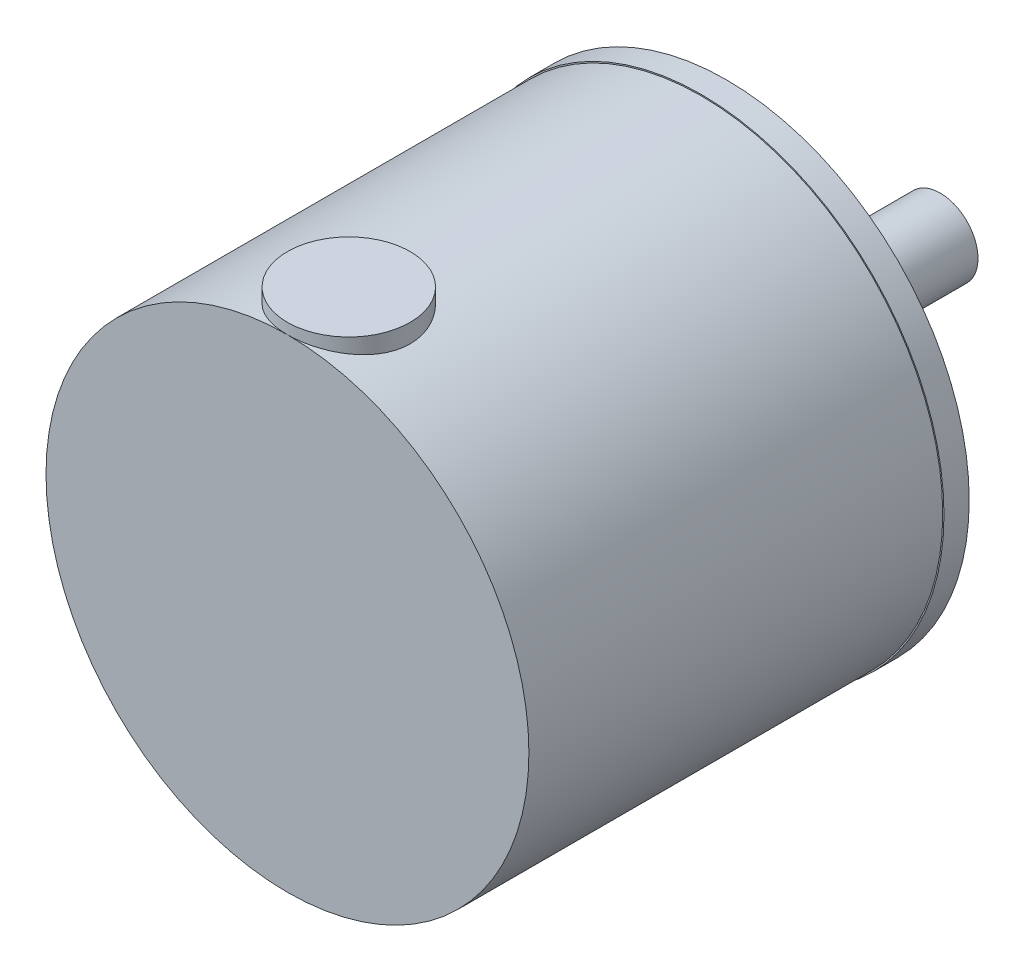
from build123d import *

# Parameters (mm, degrees)
CROQUIS1_R              = 19.15
SALIENTE_EXTRUIR1_DEPTH = 34.82
CROQUIS2_R              = 9.975
SALIENTE_EXTRUIR2_DEPTH = 4.95
SALIENTE_EXTRUIR3_DEPTH = 12
CROQUIS4_R              = 4.865
SALIENTE_EXTRUIR4_DEPTH = 20
CROQUIS5_R              = 19.25
SALIENTE_EXTRUIR5_DEPTH = 2
CROQUIS6_R              = 1.5
CORTAR_EXTRUIR1_DEPTH   = 5


with BuildPart() as part:
    # Croquis1 → Saliente-Extruir1 (new body)
    with BuildSketch(Plane.XY):
        Circle(CROQUIS1_R)
    extrude(amount=SALIENTE_EXTRUIR1_DEPTH)

    # Croquis2 → Saliente-Extruir2 (add)
    with BuildSketch(Plane(origin=(0, 0, 0), x_dir=(-1, 0, 0), z_dir=(0, 0, -1))):
        with Locations(Location((0, 0, 0), (0, 0, 180))):
            Circle(CROQUIS2_R)
    extrude(amount=SALIENTE_EXTRUIR2_DEPTH)

    # Croquis3 → Saliente-Extruir3 (add)
    with BuildSketch(Plane(origin=(0, 0, -4.95), x_dir=(-1, 0, 0), z_dir=(0, 0, -1))):
        with BuildLine():
            Line((-1.839320527, -2.37), (1.839320527, -2.37))
            ThreePointArc((1.839320527, -2.37), (0, 3), (-1.839320527, -2.37))
        make_face()
    extrude(amount=SALIENTE_EXTRUIR3_DEPTH)

    # Croquis4 → Saliente-Extruir4 (add)
    with BuildSketch(Plane(origin=(0, 0, 0), x_dir=(1, 0, 0), z_dir=(0, 1, 0))):
        with Locations(Location((0, -29.955, 0), (0, 0, 270))):
            Circle(CROQUIS4_R)
    extrude(amount=SALIENTE_EXTRUIR4_DEPTH)

    # Croquis5 → Saliente-Extruir5 (add)
    with BuildSketch(Plane(origin=(0, 0, 0), x_dir=(-1, 0, 0), z_dir=(0, 0, -1))):
        Circle(CROQUIS5_R)
    extrude(amount=-SALIENTE_EXTRUIR5_DEPTH)

    # Croquis6 → Cortar-Extruir1 (cut)
    with BuildSketch(Plane(origin=(0, 0, 0), x_dir=(-1, 0, 0), z_dir=(0, 0, -1))):
        with Locations((-10.962942032, 9.38867591)):
            Circle(CROQUIS6_R)
        with Locations((13.612302862, 4.799848345)):
            Circle(CROQUIS6_R)
        with Locations((-2.64936083, -14.188524255)):
            Circle(CROQUIS6_R)
    extrude(amount=-CORTAR_EXTRUIR1_DEPTH, mode=Mode.SUBTRACT)


solid = part.part
